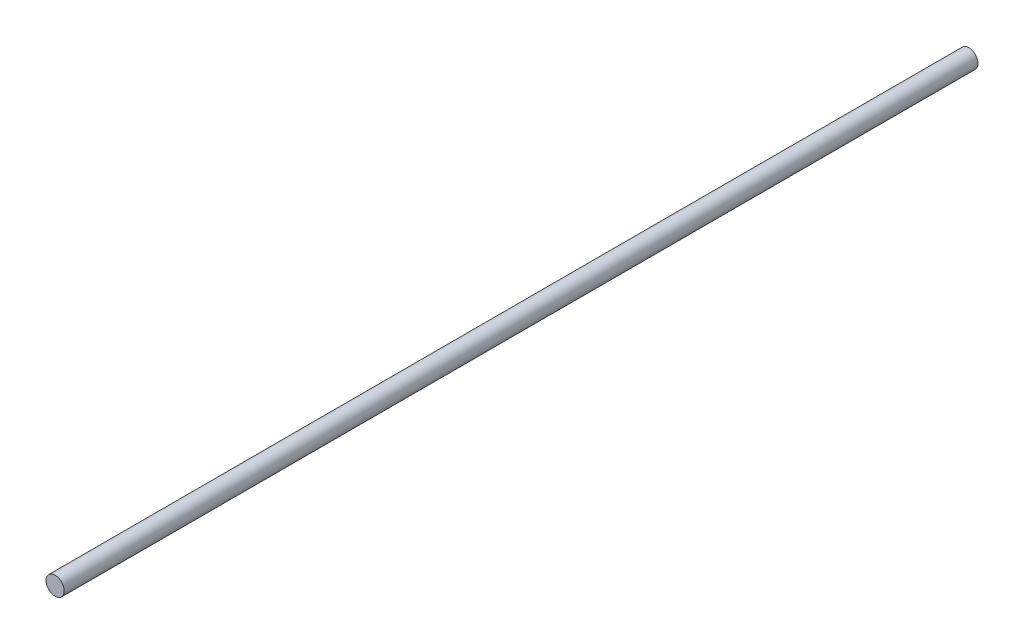
from build123d import *

# Parameters (mm, degrees)
SKETCH1_R           = 15
BOSS_EXTRUDE1_DEPTH = 1500


with BuildPart() as part:
    # Sketch1 → Boss-Extrude1 (new body)
    with BuildSketch(Plane.XY):
        Circle(SKETCH1_R)
    extrude(amount=BOSS_EXTRUDE1_DEPTH)


solid = part.part
